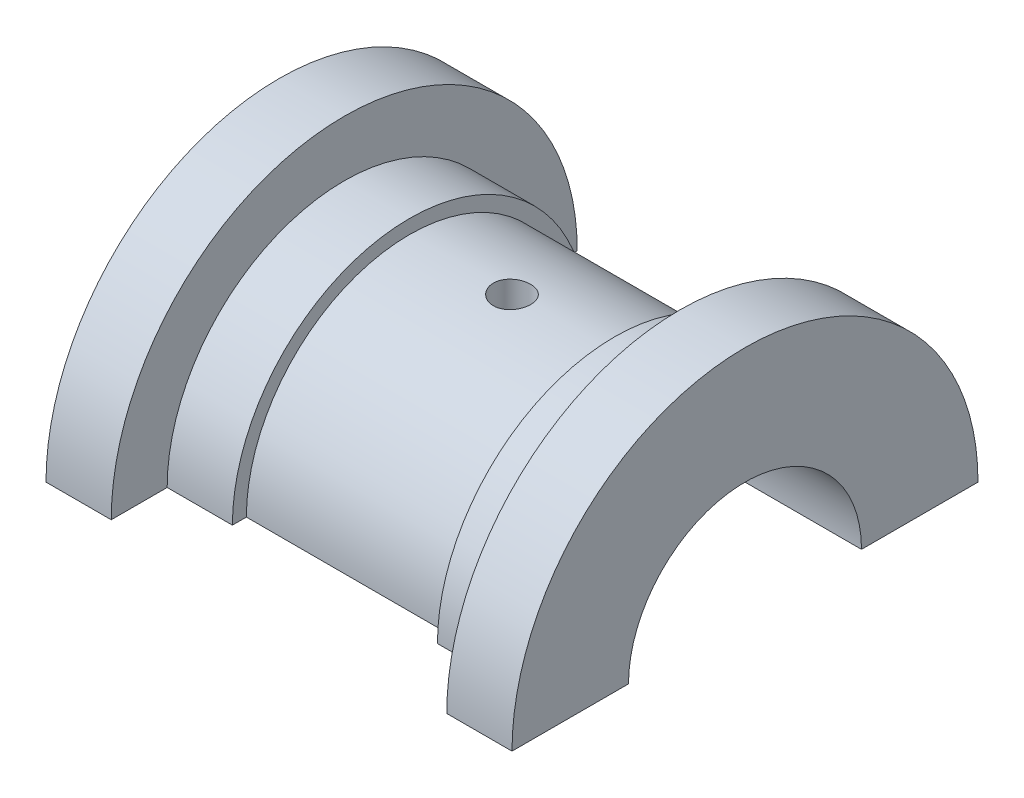
from build123d import *

# Parameters (mm, degrees)
SKETCH2_R               = 12.5
CUT_EXTRUDE1_DEPTH      = 62.23724357
CUT_EXTRUDE2_DEPTH      = 62.23724357
CUT_EXTRUDE2_DEPTH_BACK = 62.23724357
SKETCH4_R               = 2
CUT_EXTRUDE3_DEPTH      = 40.449334595


with BuildPart() as part:
    # Sketch1 → Revolve1 (revolve)
    with BuildSketch(Plane.XY, mode=Mode.PRIVATE) as revolve1_sk:
        Polygon((-25, 0), (25, 0), (25, 25), (18, 25), (18, 19), (11, 19), (11, 17.5), (-11, 17.5), (-11, 19), (-18, 19), (-18, 25), (-25, 25), align=None)
    revolve(revolve1_sk.sketch.rotate(Axis((-25, 0, 0), (1, 0, 0)), 90), axis=Axis((-25, 0, 0), (1, 0, 0)))

    # Sketch2 → Cut-Extrude1 (cut, through all)
    with BuildSketch(Plane(origin=(25, 0, 0), x_dir=(0, 0, -1), z_dir=(1, 0, 0))):
        Circle(SKETCH2_R)
    extrude(amount=-CUT_EXTRUDE1_DEPTH, mode=Mode.SUBTRACT)

    # Sketch3 → Cut-Extrude2 (cut, two sides: drawn at the far end of the back side and taken through both)
    with BuildSketch(Plane(origin=(25, 0, 0), x_dir=(0, 0, -1), z_dir=(1, 0, 0)).offset(-CUT_EXTRUDE2_DEPTH_BACK)):
        Polygon((-146.803398875, 0), (-25, 0), (25, 0), (146.803398875, 0), (146.803398875, -243.60679775), (-146.803398875, -243.60679775), align=None)
    extrude(amount=CUT_EXTRUDE2_DEPTH + CUT_EXTRUDE2_DEPTH_BACK, mode=Mode.SUBTRACT)

    # Sketch4 → Cut-Extrude3 (cut, through all)
    with BuildSketch(Plane(origin=(0, 17.5, 0), x_dir=(1, 0, 0), z_dir=(0, 1, 0))):
        with Locations(Location((0, 0, 0), (0, 0, 270))):
            Circle(SKETCH4_R)
    extrude(amount=-CUT_EXTRUDE3_DEPTH, mode=Mode.SUBTRACT)


solid = part.part
